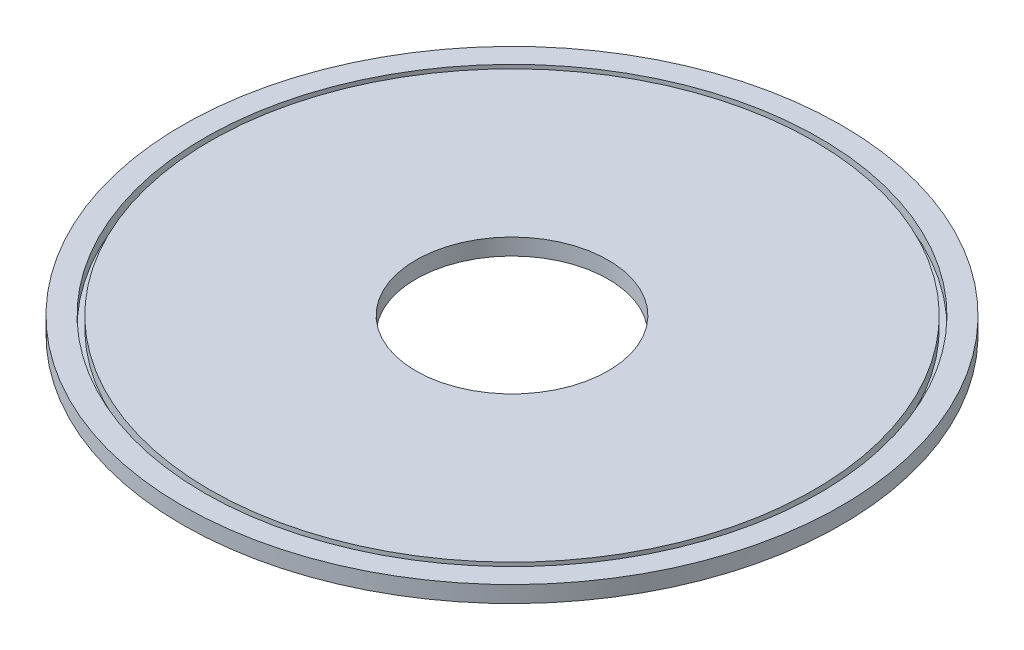
from build123d import *

# Parameters (mm, degrees)
SKETCH1_R          = 300
PLATE_DEPTH        = 15
SKETCH2_R          = 87.5
BEARING_HOLE_DEPTH = 425.529150943
SKETCH4_R          = 280
SKETCH4_R_2        = 275
CUT_EXTRUDE3_DEPTH = 10


with BuildPart() as part:
    # Sketch1 → plate (new body)
    with BuildSketch(Plane(origin=(0, 0, 0), x_dir=(1, 0, 0), z_dir=(0, 1, 0))):
        with Locations(Location((0, 0, 0), (0, 0, 270))):
            Circle(SKETCH1_R)
    extrude(amount=PLATE_DEPTH)

    # Sketch2 → bearing-hole (cut, through all)
    with BuildSketch(Plane(origin=(0, 15, 0), x_dir=(1, 0, 0), z_dir=(0, 1, 0))):
        with Locations(Location((0, 0, 0), (0, 0, 270))):
            Circle(SKETCH2_R)
    extrude(amount=-BEARING_HOLE_DEPTH, mode=Mode.SUBTRACT)

    # Sketch4 → Cut-Extrude3 (cut)
    with BuildSketch(Plane(origin=(0, 15, 0), x_dir=(1, 0, 0), z_dir=(0, 1, 0))):
        with Locations(Location((0, 0, 0), (0, 0, 270))):
            Circle(SKETCH4_R)
        with Locations(Location((0, 0, 0), (0, 0, 270))):
            Circle(SKETCH4_R_2, mode=Mode.SUBTRACT)
    extrude(amount=-CUT_EXTRUDE3_DEPTH, mode=Mode.SUBTRACT)


solid = part.part
